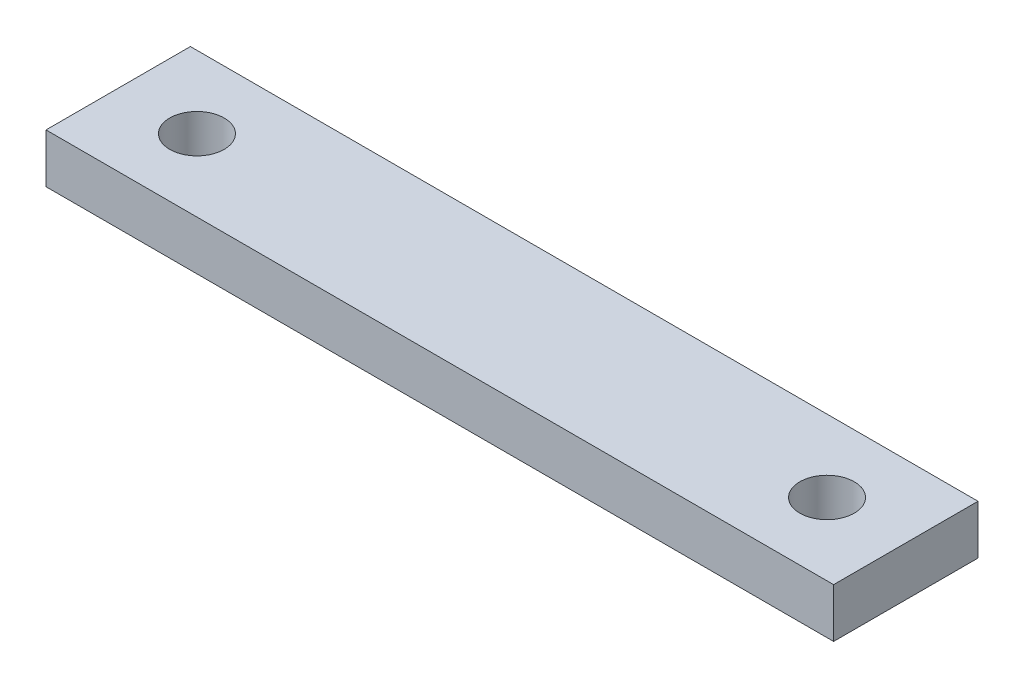
from build123d import *

# Parameters (mm, degrees)
SKETCH_1_W          = 240
SKETCH_1_H          = 15
TOP_BEAM_DEPTH      = 44
SKETCH_2_R          = 8.3
SCREW_PASSAGE_DEPTH = 245.460630777
SKETCH_3_R          = 8.3
CUT_EXTRUDE_2_DEPTH = 245.460630777


with BuildPart() as part:
    # 草图1 → Top_beam (new body)
    with BuildSketch(Plane.XY):
        with Locations((120, 7.5)):
            Rectangle(SKETCH_1_W, SKETCH_1_H)
    extrude(amount=TOP_BEAM_DEPTH)

    # 草图2 → Screw_passage (cut, through all)
    with BuildSketch(Plane(origin=(0, 15, 0), x_dir=(1, 0, 0), z_dir=(0, 1, 0))):
        with Locations(Location((24, -22, 0), (0, 0, 270))):
            Circle(SKETCH_2_R)
    extrude(amount=-SCREW_PASSAGE_DEPTH, mode=Mode.SUBTRACT)

    # 草图3 → 切除-拉伸2 (cut, through all)
    with BuildSketch(Plane(origin=(0, 15, 0), x_dir=(1, 0, 0), z_dir=(0, 1, 0))):
        with Locations(Location((216, -22, 0), (0, 0, 270))):
            Circle(SKETCH_3_R)
    extrude(amount=-CUT_EXTRUDE_2_DEPTH, mode=Mode.SUBTRACT)


solid = part.part
